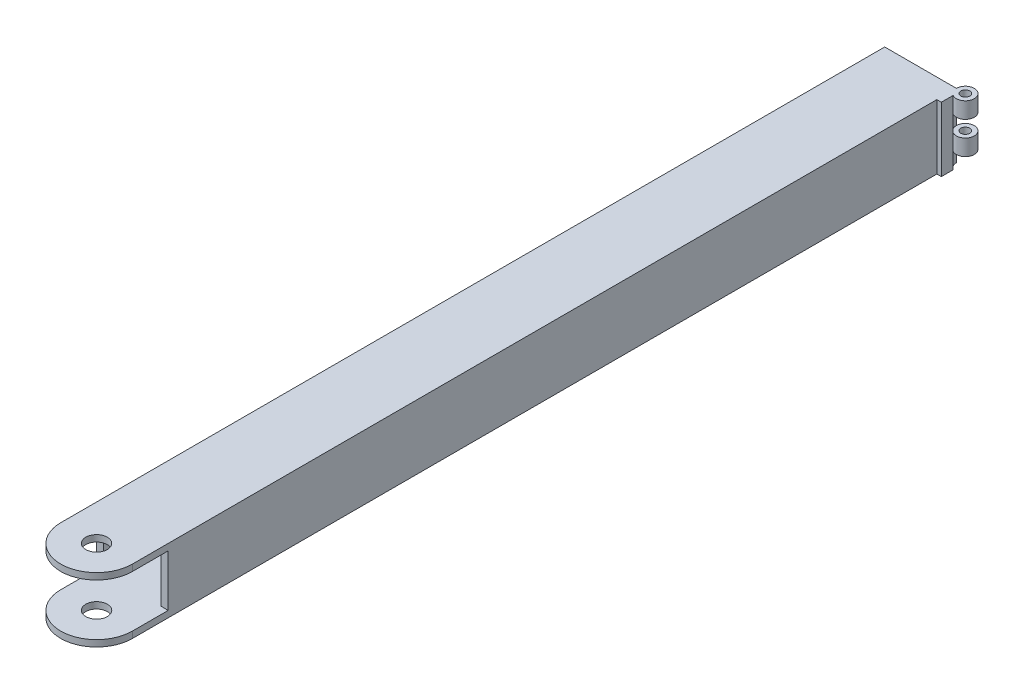
from build123d import *

# Parameters (mm, degrees)
SKETCH1_W               = 40
SKETCH1_H               = 36
SKETCH1_W_2             = 32
SKETCH1_H_2             = 28.8
BOSS_EXTRUDE1_DEPTH     = 480
SKETCH2_W               = 50
SKETCH2_H               = 28.8
CUT_EXTRUDE1_DEPTH      = 40
FILLET2_RADIUS          = 20
FILLET2_LENGTH          = 3.6
FILLET3_RADIUS          = 20
FILLET3_LENGTH          = 3.6
CUT_EXTRUDE2_DEPTH      = 482.763427421
CUT_EXTRUDE2_DEPTH_BACK = 482.763427421
SKETCH3_R               = 6
SKETCH4_R               = 2.5
BOSS_EXTRUDE2_DEPTH     = 36
CUT_EXTRUDE3_START      = 9
SKETCH5_R               = 5
CUT_EXTRUDE3_DEPTH      = 9
CUT_EXTRUDE4_START      = -9
SKETCH7_R               = 5
CUT_EXTRUDE4_DEPTH      = 9


with BuildPart() as part:
    # Sketch1 → Boss-Extrude1 (new body)
    with BuildSketch(Plane.XY):
        Rectangle(SKETCH1_W, SKETCH1_H)
        Rectangle(SKETCH1_W_2, SKETCH1_H_2, mode=Mode.SUBTRACT)
    extrude(amount=BOSS_EXTRUDE1_DEPTH)

    # Sketch2 → Cut-Extrude1 (cut)
    with BuildSketch(Plane.XY.offset(480)):
        Rectangle(SKETCH2_W, SKETCH2_H)
    extrude(amount=-CUT_EXTRUDE1_DEPTH, mode=Mode.SUBTRACT)

    # Fillet2: full round fillet: the end face becomes a half cylinder, R = half its width
    fillet2_face = Plane((0, -16.2, 480), x_dir=(0, -1, 0), z_dir=(0, 0, 1))  # on the end face: x along it, z out of the body
    fillet2_slab = fillet2_face.offset(-FILLET2_RADIUS / 2) * Box(FILLET2_LENGTH, 2 * FILLET2_RADIUS, FILLET2_RADIUS, mode=Mode.PRIVATE)  # the body's end, R deep
    fillet2_round = Plane((0, -16.2, 460), x_dir=(0, 0, 1), z_dir=(0, -1, 0)) * Cylinder(FILLET2_RADIUS, FILLET2_LENGTH, mode=Mode.PRIVATE)  # its axis R under the face
    add(fillet2_slab - fillet2_round, mode=Mode.SUBTRACT)

    # Fillet3: full round fillet: the end face becomes a half cylinder, R = half its width
    fillet3_face = Plane((0, 16.2, 480), x_dir=(0, -1, 0), z_dir=(0, 0, 1))  # on the end face: x along it, z out of the body
    fillet3_slab = fillet3_face.offset(-FILLET3_RADIUS / 2) * Box(FILLET3_LENGTH, 2 * FILLET3_RADIUS, FILLET3_RADIUS, mode=Mode.PRIVATE)  # the body's end, R deep
    fillet3_round = Plane((0, 16.2, 460), x_dir=(0, 0, 1), z_dir=(0, -1, 0)) * Cylinder(FILLET3_RADIUS, FILLET3_LENGTH, mode=Mode.PRIVATE)  # its axis R under the face
    add(fillet3_slab - fillet3_round, mode=Mode.SUBTRACT)

    # Sketch3 → Cut-Extrude2 (cut, two sides: drawn at the far end of the back side and taken through both)
    with BuildSketch(Plane(origin=(0, 18, 0), x_dir=(1, 0, 0), z_dir=(0, 1, 0)).offset(-CUT_EXTRUDE2_DEPTH_BACK)):
        with Locations(Location((0, -460, 0), (0, 0, 270))):
            Circle(SKETCH3_R)
    extrude(amount=CUT_EXTRUDE2_DEPTH + CUT_EXTRUDE2_DEPTH_BACK, mode=Mode.SUBTRACT)

    # Sketch4 → Boss-Extrude2 (add)
    with BuildSketch(Plane.XZ.offset(18)):
        with BuildLine():
            Line((20, 0), (20, 10.898129461))
            Line((20, 10.898129461), (22.5, 10.898129461))
            Line((22.5, 10.898129461), (22.5, 4.330127019))
            ThreePointArc((22.5, 4.330127019), (29.330127019, -2.5), (20, 0))
        make_face()
        with Locations(Location((25, 0, 0), (0, 0, 270))):
            Circle(SKETCH4_R, mode=Mode.SUBTRACT)
    extrude(amount=-BOSS_EXTRUDE2_DEPTH)

    # Sketch5 → Cut-Extrude3 (cut)
    with BuildSketch(Plane(origin=(0, -9, 0), x_dir=(-1, 0, 0), z_dir=(0, -1, 0)).offset(CUT_EXTRUDE3_START)):
        with Locations((-25, 0)):
            Circle(SKETCH5_R)
    extrude(amount=-CUT_EXTRUDE3_DEPTH, mode=Mode.SUBTRACT)

    # Sketch7 → Cut-Extrude4 (cut)
    with BuildSketch(Plane(origin=(0, 9, 0), x_dir=(1, 0, 0), z_dir=(0, 1, 0)).offset(CUT_EXTRUDE4_START)):
        with Locations((25, 0)):
            Circle(SKETCH7_R)
    extrude(amount=CUT_EXTRUDE4_DEPTH, mode=Mode.SUBTRACT)


solid = part.part
